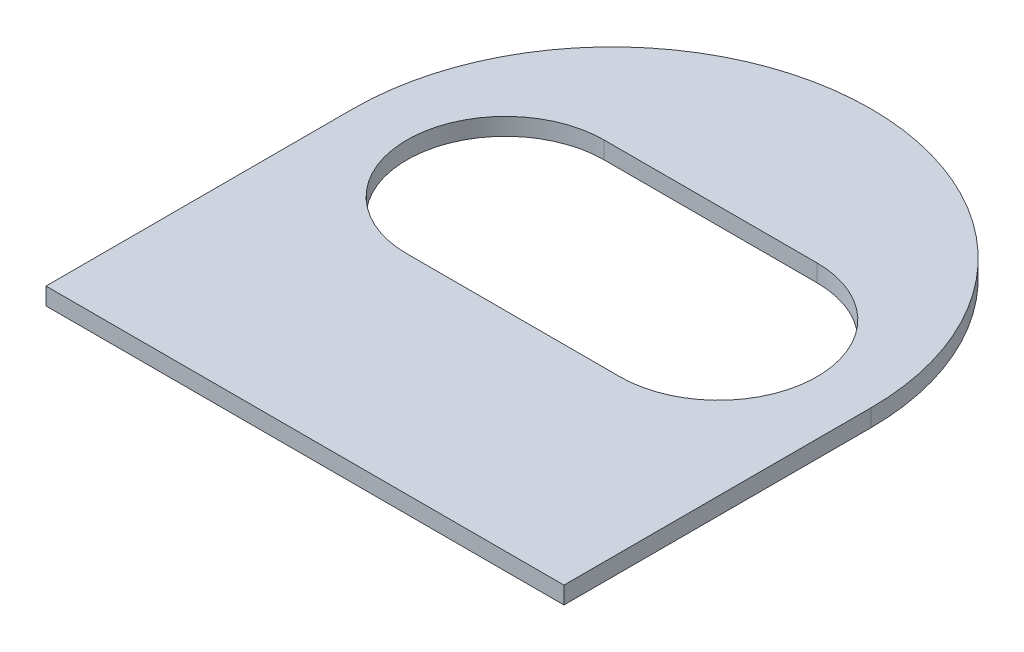
from build123d import *

# Parameters (mm, degrees)
BOSS_EXTRUDE1_DEPTH = 2


with BuildPart() as part:
    # Sketch1 → Boss-Extrude1 (new body)
    with BuildSketch(Plane(origin=(0, 0, 0), x_dir=(1, 0, 0), z_dir=(0, 1, 0))):
        with BuildLine():
            Line((-30, 0), (-30, -35.56))
            Line((-30, -35.56), (30, -35.56))
            Line((30, -35.56), (30, 0))
            ThreePointArc((30, 0), (0, 30), (-30, 0))
        make_face()
        with BuildLine():
            Line((12.336270574, -11.418953413), (-12.336270574, -11.418953413))
            ThreePointArc((-12.336270574, -11.418953413), (-23.755223987, 0), (-12.336270574, 11.418953413))
            Line((-12.336270574, 11.418953413), (12.336270574, 11.418953413))
            ThreePointArc((12.336270574, 11.418953413), (23.755223987, 0), (12.336270574, -11.418953413))
        make_face(mode=Mode.SUBTRACT)
    extrude(amount=BOSS_EXTRUDE1_DEPTH)


solid = part.part
